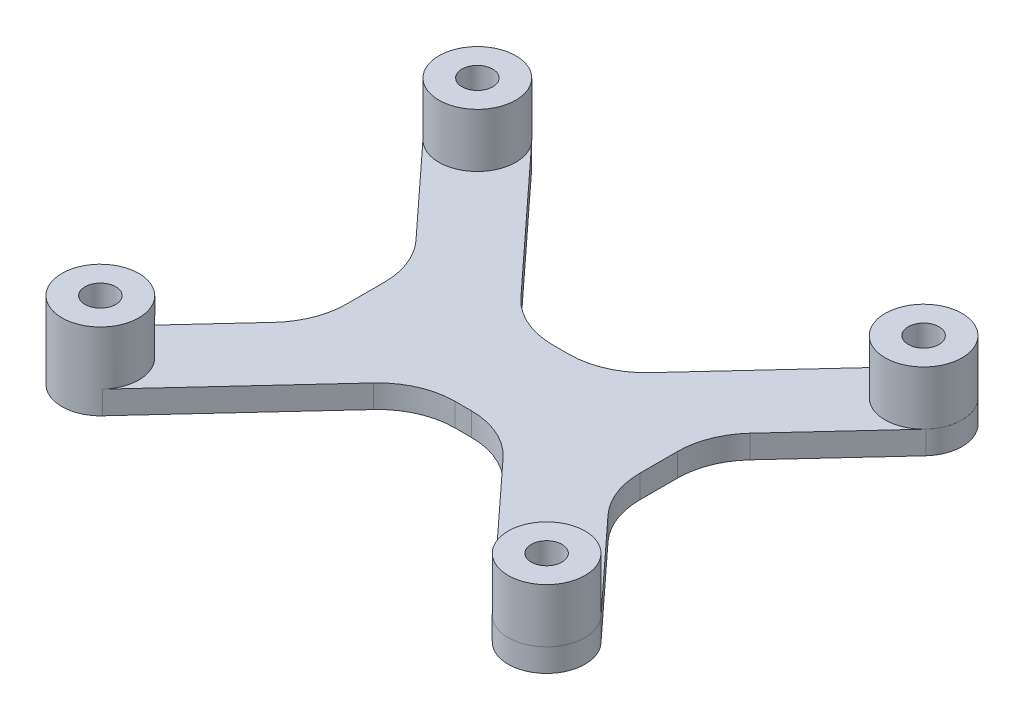
from build123d import *
from build123d.topology import SkipClean

# Parameters (mm, degrees)
SKETCH2_R             = 5
BOSS_EXTRUDE1_DEPTH   = 7
BOSS_EXTRUDE1_2_DEPTH = 7
BOSS_EXTRUDE1_3_DEPTH = 7
BOSS_EXTRUDE1_4_DEPTH = 7
SKETCH3_R             = 2
CUT_EXTRUDE2_DEPTH    = 4.8
SKETCH4_W             = 38.1
SKETCH4_H             = 12.7
BOSS_EXTRUDE2_DEPTH   = 3
BOSS_EXTRUDE3_DEPTH   = 3
MIRROR4_COPY_1_DEPTH  = 3
FILLET1_R             = 10


with BuildPart() as part:
    # Sketch2 → Boss-Extrude1 (new body)
    with BuildSketch(Plane(origin=(0, 0, 0), x_dir=(1, 0, 0), z_dir=(0, 1, 0))):
        with Locations(Location((-29, 24.5, 0), (0, 0, 270))):
            Circle(SKETCH2_R)
    extrude(amount=BOSS_EXTRUDE1_DEPTH)


with BuildPart() as body_2:
    # Sketch2 → Boss-Extrude1 2 (new body)
    with BuildSketch(Plane(origin=(0, 0, 0), x_dir=(1, 0, 0), z_dir=(0, 1, 0))):
        with Locations(Location((-29, -24.5, 0), (0, 0, 270))):
            Circle(SKETCH2_R)
    extrude(amount=BOSS_EXTRUDE1_2_DEPTH)


with BuildPart() as body_3:
    # Sketch2 → Boss-Extrude1 3 (new body)
    with BuildSketch(Plane(origin=(0, 0, 0), x_dir=(1, 0, 0), z_dir=(0, 1, 0))):
        with Locations(Location((29, 24.5, 0), (0, 0, 270))):
            Circle(SKETCH2_R)
    extrude(amount=BOSS_EXTRUDE1_3_DEPTH)


with BuildPart() as body_4:
    # Sketch2 → Boss-Extrude1 4 (new body)
    with BuildSketch(Plane(origin=(0, 0, 0), x_dir=(1, 0, 0), z_dir=(0, 1, 0))):
        with Locations(Location((29, -24.5, 0), (0, 0, 270))):
            Circle(SKETCH2_R)
    extrude(amount=BOSS_EXTRUDE1_4_DEPTH)


with BuildPart() as cut_extrude2_tool:
    # Sketch3 → Cut-Extrude2 (new body)
    with BuildSketch(Plane(origin=(0, 7, 0), x_dir=(1, 0, 0), z_dir=(0, 1, 0))):
        with Locations(Location((-29, 24.5, 0), (0, 0, 270))):
            Circle(SKETCH3_R)
        with Locations(Location((-29, -24.5, 0), (0, 0, 270))):
            Circle(SKETCH3_R)
        with Locations(Location((29, -24.5, 0), (0, 0, 270))):
            Circle(SKETCH3_R)
        with Locations(Location((29, 24.5, 0), (0, 0, 270))):
            Circle(SKETCH3_R)
    extrude(amount=-CUT_EXTRUDE2_DEPTH)


with BuildPart() as part_1:
    add(part.part)

    # Cut-Extrude2: cut by cut_extrude2_tool
    add(cut_extrude2_tool.part, mode=Mode.SUBTRACT)


with BuildPart() as body_2_1:
    add(body_2.part)

    # Cut-Extrude2: cut by cut_extrude2_tool
    add(cut_extrude2_tool.part, mode=Mode.SUBTRACT)



with BuildPart() as body_3_1:
    add(body_3.part)

    # Cut-Extrude2: cut by cut_extrude2_tool
    add(cut_extrude2_tool.part, mode=Mode.SUBTRACT)


with BuildPart() as body_4_1:
    add(body_4.part)

    # Cut-Extrude2: cut by cut_extrude2_tool
    add(cut_extrude2_tool.part, mode=Mode.SUBTRACT)


with BuildPart() as body_5:
    # Sketch4 → Boss-Extrude2 (new body)
    with BuildSketch(Plane(origin=(0, 0, 0), x_dir=(1, 0, 0), z_dir=(0, 1, 0))):
        Rectangle(SKETCH4_W, SKETCH4_H)
    extrude(amount=-BOSS_EXTRUDE2_DEPTH)


with BuildPart() as body_2_2:
    with SkipClean():  # the faces are left unmerged after this step: merging them gives an invalid solid
        add(body_2_1.part)

        add(body_5.part)  # Boss-Extrude3 merges body 5
        # Sketch5 → Boss-Extrude3 (add)
        with BuildSketch(Plane(origin=(0, 0, 0), x_dir=(1, 0, 0), z_dir=(0, 1, 0))):
            with BuildLine():
                Line((-5.44059921, -6.35), (-19.05, -6.35))
                Line((-19.05, -6.35), (-32.67393104, -21.108506124))
                ThreePointArc((-32.67393104, -21.108506124), (-32.391493876, -28.17393104), (-25.32606896, -27.891493876))
                Line((-25.32606896, -27.891493876), (-5.44059921, -6.35))
            make_face()
        boss_extrude3 = extrude(amount=-BOSS_EXTRUDE3_DEPTH)

    # Mirror3: Boss-Extrude3 across plane
    with SkipClean():  # the faces are left unmerged after this step: merging them gives an invalid solid
        add(boss_extrude3.mirror(Plane(origin=(0, 0, 0), x_dir=(0, 0, 1), z_dir=(1, 0, 0))))

    # Mirror4: Boss-Extrude3 across plane
    with SkipClean():  # the faces are left unmerged after this step: merging them gives an invalid solid
        add(boss_extrude3.mirror(Plane.XY))

    # Mirror4 copy 1 sketch → Mirror4 copy 1 (add)
    with SkipClean():  # the faces are left unmerged after this step: merging them gives an invalid solid
        with BuildSketch(Plane(origin=(0, 0, 0), x_dir=(-1, 0, 0), z_dir=(0, 1, 0))):
            with BuildLine():
                Line((-5.44059921, -6.35), (-19.05, -6.35))
                Line((-19.05, -6.35), (-32.67393104, -21.108506124))
                ThreePointArc((-32.67393104, -21.108506124), (-32.391493876, -28.17393104), (-25.32606896, -27.891493876))
                Line((-25.32606896, -27.891493876), (-5.44059921, -6.35))
            make_face()
        extrude(amount=-MIRROR4_COPY_1_DEPTH)

    # Fillet1
    fillet1_edges = [body_2_2.edges().sort_by_distance(p)[0] for p in [
        (-19.05, -1.5, 6.35),
        (-5.44059921, -1.5, 6.35),
        (19.05, -1.5, 6.35),
        (19.05, -1.5, -6.35),
        (-19.05, -1.5, -6.35),
        (5.44059921, -1.5, 6.35),
        (5.44059921, -1.5, -6.35),
        (-5.44059921, -1.5, -6.35),
    ]]
    fillet(fillet1_edges, radius=FILLET1_R)


solid = Compound([part_1.part, body_3_1.part, body_4_1.part, body_2_2.part])
